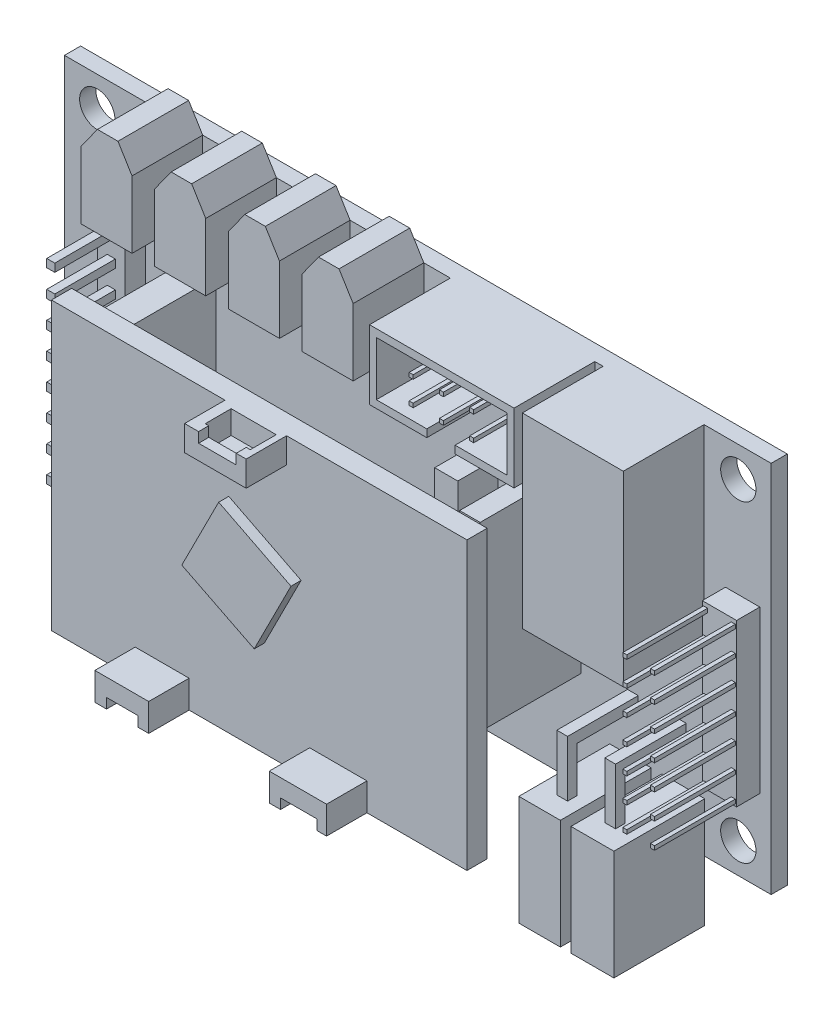
from build123d import *

# Parameters (mm, degrees)
SKETCH_1_W          = 70
SKETCH_1_H          = 37
EXTRUDE_1_DEPTH     = 1.6
SKETCH_2_R          = 1.75
CUT_EXTRUDE_1_DEPTH = 1.6
SKETCH_3_W          = 3.4
SKETCH_3_H          = 16
EXTRUDE_2_DEPTH     = 2.3
SKETCH_4_W          = 0.4
SKETCH_4_H          = 0.4
EXTRUDE_3_DEPTH     = 8
SKETCH_5_W          = 10
SKETCH_5_H          = 18.5
EXTRUDE_4_DEPTH     = 8
EXTRUDE_5_DEPTH     = 8
SKETCH_7_W          = 0.4
SKETCH_7_H          = 0.4
EXTRUDE_6_DEPTH     = 8
SKETCH_8_W          = 2.879584686
SKETCH_8_H          = 25.487227547
EXTRUDE_7_DEPTH     = 11
SKETCH_9_R          = 4.178022028
EXTRUDE_11_DEPTH    = 8
SKETCH_10_W         = 2.032648014
SKETCH_10_H         = 17.955057455
EXTRUDE_12_DEPTH    = 10
SKETCH_11_W         = 41.161122279
SKETCH_11_H         = 28.366812234
EXTRUDE_13_DEPTH    = 2
SKETCH_12_W         = 2.286729016
SKETCH_12_H         = 8.723447726
EXTRUDE_14_DEPTH    = 4
SKETCH_13_W         = 5.335701036
SKETCH_13_H         = 2.739440835
SKETCH_13_W_2       = 5.674475705
SKETCH_13_W_3       = 6.097944041
SKETCH_13_H_2       = 2.506000242
EXTRUDE_15_DEPTH    = 4
SKETCH_14_W         = 3.119033187
SKETCH_14_H         = 1
SKETCH_14_W_2       = 3.634700493
SKETCH_14_W_3       = 3.721809545
CUT_EXTRUDE_2_DEPTH = 3.4
SKETCH_15_W         = 4.637203985
SKETCH_15_H         = 2.335282583
SKETCH_15_W_2       = 4.703926345
CUT_EXTRUDE_3_DEPTH = 2.5
SKETCH_16_W         = 4.461555363
SKETCH_16_H         = 2.572428318
CUT_EXTRUDE_4_DEPTH = 2.3
SKETCH_17_W         = 5.30943753
SKETCH_17_H         = 2.946234025
SKETCH_17_W_2       = 5.659510334
SKETCH_17_H_2       = 3
EXTRUDE_16_DEPTH    = 3.4
SKETCH_18_W         = 3.617477322
SKETCH_18_H         = 1.923899619
SKETCH_18_H_2       = 1.977665594
CUT_EXTRUDE_5_DEPTH = 2.5
EXTRUDE_17_DEPTH    = 1
EXTRUDE_18_DEPTH    = 7
SKETCH_21_W         = 1.064575704
SKETCH_21_H         = 1.064575704
EXTRUDE_19_DEPTH    = 7
SKETCH_22_W         = 1.064575704
SKETCH_22_H         = 0.917949498
EXTRUDE_20_DEPTH    = 5
SKETCH_23_W         = 4.114335653
SKETCH_23_H         = 10.878582404
SKETCH_23_W_2       = 4.253804658
EXTRUDE_21_DEPTH    = 9
SKETCH_24_W         = 3.536285053
SKETCH_24_H         = 3.869896851
SKETCH_24_H_2       = 3.769813311
SKETCH_24_W_2       = 3.569646233
CUT_EXTRUDE_6_DEPTH = 9
SKETCH_25_W         = 2.742560388
SKETCH_25_H         = 21.340548017
EXTRUDE_22_DEPTH    = 2
SKETCH_26_W         = 0.8
SKETCH_26_H         = 0.8
EXTRUDE_23_DEPTH    = 6


with BuildPart() as part:
    # 草图1 → 凸台-拉伸1 (new body)
    with BuildSketch(Plane.XY):
        Rectangle(SKETCH_1_W, SKETCH_1_H)
    extrude(amount=EXTRUDE_1_DEPTH)

    # 草图2 → 切除-拉伸1 (cut)
    with BuildSketch(Plane.XY.offset(1.6)):
        with Locations((-31.75, 15.5)):
            Circle(SKETCH_2_R)
        with Locations((31.75, 15.5)):
            Circle(SKETCH_2_R)
        with Locations((31.75, -15.5)):
            Circle(SKETCH_2_R)
        with Locations((-31.75, -15.5)):
            Circle(SKETCH_2_R)
    extrude(amount=-CUT_EXTRUDE_1_DEPTH, mode=Mode.SUBTRACT)

    # 草图3 → 凸台-拉伸2 (add)
    with BuildSketch(Plane.XY.offset(1.6)):
        with Locations((32.177466897, -2.390120742)):
            Rectangle(SKETCH_3_W, SKETCH_3_H)
    extrude(amount=EXTRUDE_2_DEPTH)

    # 草图4 → 凸台-拉伸3 (add)
    with BuildSketch(Plane.XY.offset(3.9)):
        with Locations((33.551119411, 5.021883194)):
            Rectangle(SKETCH_4_W, SKETCH_4_H)
        with Locations((30.803814382, 5.021883194)):
            Rectangle(SKETCH_4_W, SKETCH_4_H)
        with Locations((30.803814382, 2.521883194)):
            Rectangle(SKETCH_4_W, SKETCH_4_H)
        with Locations((33.551119411, 2.521883194)):
            Rectangle(SKETCH_4_W, SKETCH_4_H)
        with Locations((30.803814382, 0.021883194)):
            Rectangle(SKETCH_4_W, SKETCH_4_H)
        with Locations((33.551119411, 0.021883194)):
            Rectangle(SKETCH_4_W, SKETCH_4_H)
        with Locations((30.803814382, -2.478116806)):
            Rectangle(SKETCH_4_W, SKETCH_4_H)
        with Locations((33.551119411, -2.478116806)):
            Rectangle(SKETCH_4_W, SKETCH_4_H)
        with Locations((30.803814382, -4.978116806)):
            Rectangle(SKETCH_4_W, SKETCH_4_H)
        with Locations((33.551119411, -4.978116806)):
            Rectangle(SKETCH_4_W, SKETCH_4_H)
        with Locations((30.803814382, -7.478116806)):
            Rectangle(SKETCH_4_W, SKETCH_4_H)
        with Locations((33.551119411, -7.478116806)):
            Rectangle(SKETCH_4_W, SKETCH_4_H)
        with Locations((30.803814382, -9.978116806)):
            Rectangle(SKETCH_4_W, SKETCH_4_H)
        with Locations((33.551119411, -9.978116806)):
            Rectangle(SKETCH_4_W, SKETCH_4_H)
    extrude(amount=EXTRUDE_3_DEPTH)

    # 草图5 → 凸台-拉伸4 (add)
    with BuildSketch(Plane.XY.offset(1.6)):
        with Locations((23.355439793, 9.25)):
            Rectangle(SKETCH_5_W, SKETCH_5_H)
    extrude(amount=EXTRUDE_4_DEPTH)

    # 草图6 → 凸台-拉伸5 (add)
    with BuildSketch(Plane.XY.offset(1.6)):
        Polygon((17.531589119, 18.5), (3.218359355, 18.5), (3.218359355, 11.645379246), (8.891312543, 11.645379246), (8.891312543, 12.402055959), (3.895908693, 12.402055959), (3.895908693, 17.743323287), (16.854039781, 17.743323287), (16.854039781, 12.402055959), (11.693651642, 12.402055959), (11.693651642, 11.645379246), (17.531589119, 11.645379246), align=None)
    extrude(amount=EXTRUDE_5_DEPTH)

    # 草图7 → 凸台-拉伸6 (add)
    with BuildSketch(Plane.XY.offset(1.6)):
        with Locations((7.338938974, 16.171847601)):
            Rectangle(SKETCH_7_W, SKETCH_7_H)
        with Locations((7.338938974, 13.728585281)):
            Rectangle(SKETCH_7_W, SKETCH_7_H)
        with Locations((10.338938974, 16.171847601)):
            Rectangle(SKETCH_7_W, SKETCH_7_H)
        with Locations((10.338938974, 13.728585281)):
            Rectangle(SKETCH_7_W, SKETCH_7_H)
        with Locations((13.338938974, 16.171847601)):
            Rectangle(SKETCH_7_W, SKETCH_7_H)
        with Locations((13.338938974, 13.728585281)):
            Rectangle(SKETCH_7_W, SKETCH_7_H)
    extrude(amount=EXTRUDE_6_DEPTH)

    # 草图8 → 凸台-拉伸7 (add)
    with BuildSketch(Plane.XY.offset(1.6)):
        with Locations((-21.427497812, -5.756386227)):
            Rectangle(SKETCH_8_W, SKETCH_8_H)
    extrude(amount=EXTRUDE_7_DEPTH)

    # 草图9 → 凸台-拉伸11 (add)
    with BuildSketch(Plane.XY.offset(1.6)):
        with Locations((-15.132653923, -9.753940678)):
            Circle(SKETCH_9_R)
    extrude(amount=EXTRUDE_11_DEPTH)

    # 草图10 → 凸台-拉伸12 (add)
    with BuildSketch(Plane.XY.offset(1.6)):
        with Locations((15.160166436, 0.042346833)):
            Rectangle(SKETCH_10_W, SKETCH_10_H)
    extrude(amount=EXTRUDE_12_DEPTH)

    # 草图11 → 凸台-拉伸13 (add)
    with BuildSketch(Plane.XY.offset(12.6)):
        with Locations((-2.710197351, -4.316593883)):
            Rectangle(SKETCH_11_W, SKETCH_11_H)
    extrude(amount=EXTRUDE_13_DEPTH)

    # 草图12 → 凸台-拉伸14 (add)
    with BuildSketch(Plane.XY.offset(1.6)):
        with Locations((6.817840213, 1.101017674)):
            Rectangle(SKETCH_12_W, SKETCH_12_H)
    extrude(amount=EXTRUDE_14_DEPTH)

    # 草图13 → 凸台-拉伸15 (add)
    with BuildSketch(Plane.XY.offset(14.6)):
        with Locations((-12.322928584, -17.130279583)):
            Rectangle(SKETCH_13_W, SKETCH_13_H)
        with Locations((5.123966869, -17.130279583)):
            Rectangle(SKETCH_13_W_2, SKETCH_13_H)
        with Locations((-3.048972021, 8.613812113)):
            Rectangle(SKETCH_13_W_3, SKETCH_13_H_2)
    extrude(amount=EXTRUDE_15_DEPTH)

    # 草图14 → 切除-拉伸2 (cut)
    with BuildSketch(Plane.XY.offset(18.6)):
        with Locations((-12.273793438, -18)):
            Rectangle(SKETCH_14_W, SKETCH_14_H)
        with Locations((5.220690732, -18)):
            Rectangle(SKETCH_14_W_2, SKETCH_14_H)
        with Locations((-2.851581589, 9.366812234)):
            Rectangle(SKETCH_14_W_3, SKETCH_14_H)
    extrude(amount=-CUT_EXTRUDE_2_DEPTH, mode=Mode.SUBTRACT)

    # 草图15 → 切除-拉伸3 (cut)
    with BuildSketch(Plane.XZ.offset(18.5)):
        with Locations((-12.37656431, 16.020551224)):
            Rectangle(SKETCH_15_W, SKETCH_15_H)
        with Locations((5.238138597, 16.020551224)):
            Rectangle(SKETCH_15_W_2, SKETCH_15_H)
    extrude(amount=-CUT_EXTRUDE_3_DEPTH, mode=Mode.SUBTRACT)

    # 草图16 → 切除-拉伸4 (cut)
    with BuildSketch(Plane(origin=(0, 9.866812234, 0), x_dir=(1, 0, 0), z_dir=(0, 1, 0))):
        with Locations((-2.833410878, -16.309373538)):
            Rectangle(SKETCH_16_W, SKETCH_16_H)
    extrude(amount=-CUT_EXTRUDE_4_DEPTH, mode=Mode.SUBTRACT)

    # 草图17 → 凸台-拉伸16 (add)
    with BuildSketch(Plane.XZ.offset(18.5)):
        with Locations((-12.4528817, 11.126882988)):
            Rectangle(SKETCH_17_W, SKETCH_17_H)
        with Locations((5.400831313, 11.1)):
            Rectangle(SKETCH_17_W_2, SKETCH_17_H_2)
    extrude(amount=-EXTRUDE_16_DEPTH)

    # 草图18 → 切除-拉伸5 (cut)
    with BuildSketch(Plane.XZ.offset(18.5)):
        with Locations((-12.292892067, 10.615715785)):
            Rectangle(SKETCH_18_W, SKETCH_18_H)
        with Locations((5.43274681, 10.588832797)):
            Rectangle(SKETCH_18_W, SKETCH_18_H_2)
    extrude(amount=-CUT_EXTRUDE_5_DEPTH, mode=Mode.SUBTRACT)

    # 草图19 → 凸台-拉伸17 (add)
    with BuildSketch(Plane.XY.offset(14.6)):
        Polygon((-2.202035348, -9.019875561), (1.439792343, -1.820913846), (-5.724261469, 1.803254553), (-9.378578152, -5.420394703), align=None)
    extrude(amount=EXTRUDE_17_DEPTH)

    # 草图20 → 凸台-拉伸18 (add)
    with BuildSketch(Plane.XY.offset(1.6)):
        Polygon((-4.467167479, 18.5), (-4.467167479, 11.860489715), (0.594126076, 11.860489715), (0.594126076, 18.5), (-0.801506994, 20.778599498), (-2.835429986, 20.778599498), align=None)
        Polygon((-11.767167479, 18.5), (-11.767167479, 11.860489715), (-6.705873924, 11.860489715), (-6.705873924, 18.5), (-8.101506994, 20.778599498), (-10.135429986, 20.778599498), align=None)
        Polygon((-19.067167479, 18.5), (-19.067167479, 11.860489715), (-14.005873924, 11.860489715), (-14.005873924, 18.5), (-15.401506994, 20.778599498), (-17.435429986, 20.778599498), align=None)
        Polygon((-26.367167479, 18.5), (-26.367167479, 11.860489715), (-21.305873924, 11.860489715), (-21.305873924, 18.5), (-22.701506994, 20.778599498), (-24.735429986, 20.778599498), align=None)
    extrude(amount=EXTRUDE_18_DEPTH)

    # 草图21 → 凸台-拉伸19 (add)
    with BuildSketch(Plane.XY.offset(1.6)):
        with Locations((21.304471647, -8.54069122)):
            Rectangle(SKETCH_21_W, SKETCH_21_H)
        with Locations((26.059576457, -8.54069122)):
            Rectangle(SKETCH_21_W, SKETCH_21_H)
    extrude(amount=EXTRUDE_19_DEPTH)

    # 草图22 → 凸台-拉伸20 (add)
    with BuildSketch(Plane.XZ.offset(9.072979072)):
        with Locations((21.304471647, 8.141025251)):
            Rectangle(SKETCH_22_W, SKETCH_22_H)
        with Locations((26.059576457, 8.141025251)):
            Rectangle(SKETCH_22_W, SKETCH_22_H)
    extrude(amount=EXTRUDE_20_DEPTH)

    # 草图23 → 凸台-拉伸21 (add)
    with BuildSketch(Plane.XY.offset(1.6)):
        with Locations((21.066640815, -19.001509422)):
            Rectangle(SKETCH_23_W, SKETCH_23_H)
        with Locations((26.296728509, -19.001509422)):
            Rectangle(SKETCH_23_W_2, SKETCH_23_H)
    extrude(amount=EXTRUDE_21_DEPTH)

    # 草图24 → 切除-拉伸6 (cut)
    with BuildSketch(Plane.XZ.offset(24.440800624)):
        with Locations((21.056246302, 8.385181973)):
            Rectangle(SKETCH_24_W, SKETCH_24_H)
        with Locations((21.056246302, 3.798019759)):
            Rectangle(SKETCH_24_W, SKETCH_24_H_2)
        with Locations((26.310632113, 8.385181973)):
            Rectangle(SKETCH_24_W_2, SKETCH_24_H)
        with Locations((26.310632113, 3.798019759)):
            Rectangle(SKETCH_24_W_2, SKETCH_24_H_2)
    extrude(amount=-CUT_EXTRUDE_6_DEPTH, mode=Mode.SUBTRACT)

    # 草图25 → 凸台-拉伸22 (add)
    with BuildSketch(Plane.XY.offset(1.6)):
        with Locations((-28.357776303, -1.573985527)):
            Rectangle(SKETCH_25_W, SKETCH_25_H)
    extrude(amount=EXTRUDE_22_DEPTH)

    # 草图26 → 凸台-拉伸23 (add)
    with BuildSketch(Plane.XY.offset(3.6)):
        with Locations((-28.357776303, 5.147267254)):
            Rectangle(SKETCH_26_W, SKETCH_26_H)
        with Locations((-28.357776303, 7.797267254)):
            Rectangle(SKETCH_26_W, SKETCH_26_H)
        with Locations((-28.357776303, 2.497267254)):
            Rectangle(SKETCH_26_W, SKETCH_26_H)
        with Locations((-28.357776303, -0.152732746)):
            Rectangle(SKETCH_26_W, SKETCH_26_H)
        with Locations((-28.357776303, -2.802732746)):
            Rectangle(SKETCH_26_W, SKETCH_26_H)
        with Locations((-28.357776303, -5.452732746)):
            Rectangle(SKETCH_26_W, SKETCH_26_H)
        with Locations((-28.357776303, -8.102732746)):
            Rectangle(SKETCH_26_W, SKETCH_26_H)
        with Locations((-28.357776303, -10.752732746)):
            Rectangle(SKETCH_26_W, SKETCH_26_H)
    extrude(amount=EXTRUDE_23_DEPTH)


solid = part.part
